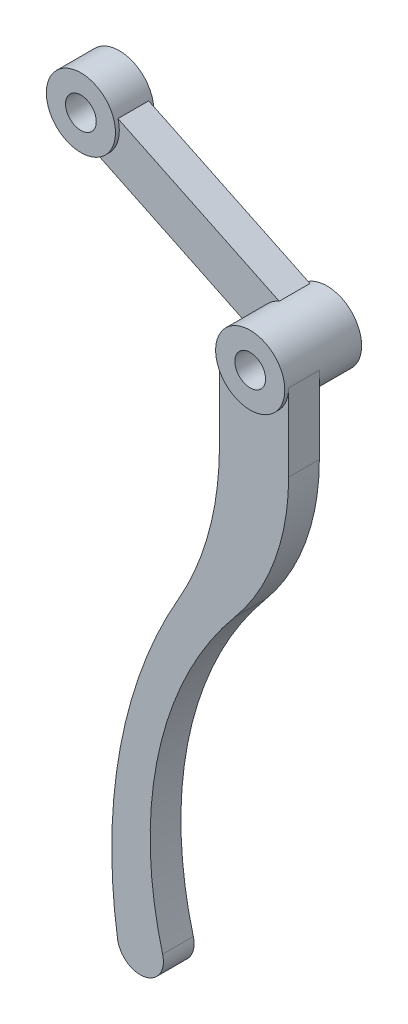
from build123d import *

# Parameters (mm, degrees)
SKETCH_1_R        = 9
SKETCH_1_R_2      = 4
EXTRUDE_1_DEPTH   = 10
EXTRUDE_1_2_DEPTH = 10
EXTRUDE_START     = -9
EXTRUDE_2_DEPTH   = 8
EXTRUDE_START_2   = 1
EXTRUDE_3_DEPTH   = 8
SKETCH_5_R        = 9
SKETCH_5_R_2      = 4
EXTRUDE_4_DEPTH   = 10


with BuildPart() as part:
    # 草图1 → 凸台-拉伸1 (new body)
    with BuildSketch(Plane.XY):
        Circle(SKETCH_1_R)
        Circle(SKETCH_1_R_2, mode=Mode.SUBTRACT)
    extrude(amount=EXTRUDE_1_DEPTH)



with BuildPart() as body_2:
    # 草图1 → Extrude 1 2 (new body)
    with BuildSketch(Plane.XY):
        with Locations((-54.075649928, 25.996616797)):
            Circle(SKETCH_1_R)
        with Locations((-54.075649928, 25.996616797)):
            Circle(SKETCH_1_R_2, mode=Mode.SUBTRACT)
    extrude(amount=EXTRUDE_1_2_DEPTH)


with BuildPart() as part_1:
    add(part.part)

    add(body_2.part)  # 凸台-拉伸2 merges body 2
    # 草图2 → 凸台-拉伸2 (add)
    with BuildSketch(Plane.XY.offset(10).offset(EXTRUDE_START)):
        with BuildLine():
            Line((-50.629470149, 17.682541688), (-8.645503138, -2.501054876))
            ThreePointArc((-8.645503138, -2.501054876), (-8.111347489, 3.89949252), (-3.446179779, 8.31407511))
            Line((-3.446179779, 8.31407511), (-45.43014679, 28.497671673))
            ThreePointArc((-45.43014679, 28.497671673), (-45.964302438, 22.097124278), (-50.629470149, 17.682541688))
        make_face()
    extrude(amount=EXTRUDE_2_DEPTH)



with BuildPart() as body_2_2:
    # 草图4 → 凸台-拉伸3 (new body)
    with BuildSketch(Plane.XY.offset(10).offset(EXTRUDE_START_2)):
        with BuildLine():
            Line((-9, 0), (-9, -22))
            ThreePointArc((-9, -22), (-11.716267411, -42.669414049), (-19.680616928, -61.935236704))
            ThreePointArc((-19.680616928, -61.935236704), (-34.813823432, -102.892867464), (-35.532086941, -146.550920033))
            ThreePointArc((-35.532086941, -146.550920033), (-28.368122981, -151.512581419), (-23.805971944, -144.087809285))
            ThreePointArc((-23.805971944, -144.087809285), (-24.813823432, -99.040827427), (-4.952136173, -58.596300996))
            ThreePointArc((-4.952136173, -58.596300996), (5.404218945, -40.589645691), (9, -20.130806888))
            Line((9, -20.130806888), (9, 0))
            ThreePointArc((9, 0), (0, -9), (-9, 0))
        make_face()
    extrude(amount=EXTRUDE_3_DEPTH)


with BuildPart() as part_2:
    add(part_1.part)

    add(body_2_2.part)  # 凸台-拉伸4 merges body 2 2
    # 草图5 → 凸台-拉伸4 (add)
    with BuildSketch(Plane.XY.offset(10)):
        Circle(SKETCH_5_R)
        Circle(SKETCH_5_R_2, mode=Mode.SUBTRACT)
    extrude(amount=EXTRUDE_4_DEPTH)


solid = part_2.part
